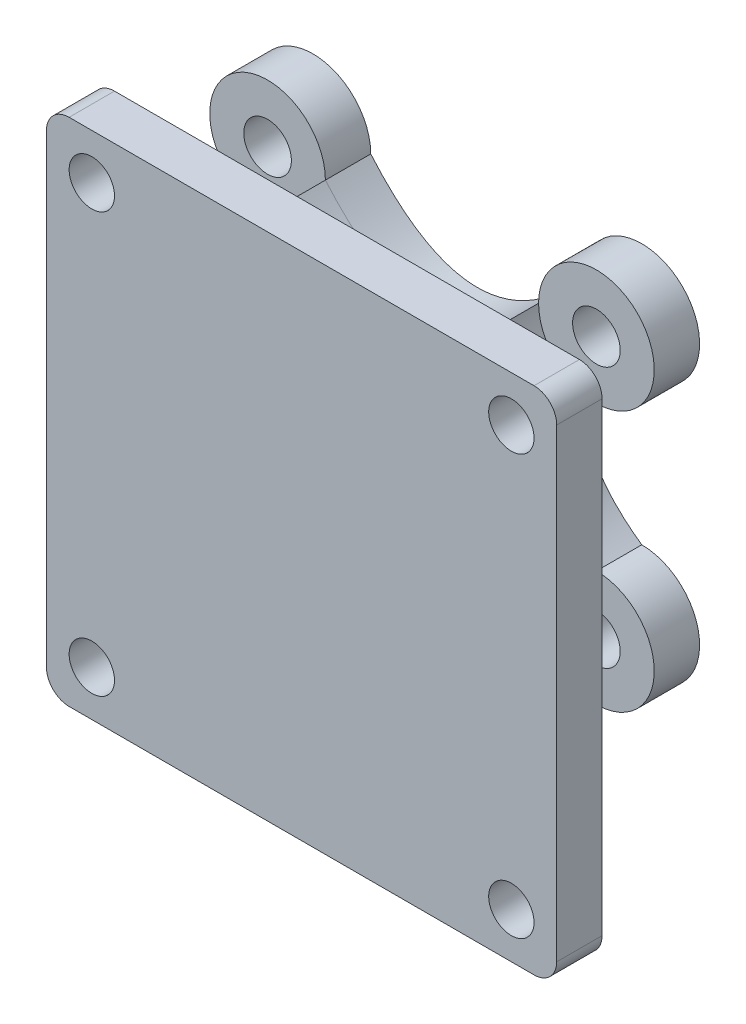
from build123d import *

# Parameters (mm, degrees)
SKETCH_1_R      = 5.1
SKETCH_1_R_2    = 2.1
EXTRUDE_1_DEPTH = 4
EXTRUDE_2_DEPTH = 11.5
SKETCH_3_R      = 2
EXTRUDE_3_DEPTH = 4


with BuildPart() as part:
    # 草圖1 → 填料-伸長1 (new body)
    # profile 1 of 5: a face of its own
    with BuildSketch(Plane.XY):
        with Locations((-14.5, 11.5)):
            Circle(SKETCH_1_R)
        with Locations((-14.5, 11.5)):
            Circle(SKETCH_1_R_2, mode=Mode.SUBTRACT)
    # profile 2 of 5: a face of its own
    with BuildSketch(Plane.XY):
        with BuildLine():
            add(Edge.make_bspline(
                [(-9.4, 11.5), (0, 0.5), (9.4, 11.5)],
                knots=[0, 0, 0, 1, 1, 1], degree=2))
            ThreePointArc((-9.4, 11.5), (-10.893755416, 7.893755416), (-14.5, 6.4))
            add(Edge.make_bspline(
                [(-14.5, 6.4), (-5.5, 0), (-14.5, -6.4)],
                knots=[0, 0, 0, 1, 1, 1], degree=2))
            ThreePointArc((-14.5, -6.4), (-10.893755416, -7.893755416), (-9.4, -11.5))
            add(Edge.make_bspline(
                [(-9.4, -11.5), (0, -0.5), (9.4, -11.5)],
                knots=[0, 0, 0, 1, 1, 1], degree=2))
            ThreePointArc((9.4, -11.5), (10.893755416, -7.893755416), (14.5, -6.4))
            add(Edge.make_bspline(
                [(14.5, 6.4), (5.5, 0), (14.5, -6.4)],
                knots=[0, 0, 0, 1, 1, 1], degree=2))
            ThreePointArc((14.5, 6.4), (10.893755416, 7.893755416), (9.4, 11.5))
        make_face()
    # profile 3 of 5: a face of its own
    with BuildSketch(Plane.XY):
        with Locations((14.5, 11.5)):
            Circle(SKETCH_1_R)
        with Locations((14.5, 11.5)):
            Circle(SKETCH_1_R_2, mode=Mode.SUBTRACT)
    # profile 4 of 5: a face of its own
    with BuildSketch(Plane.XY):
        with Locations((14.5, -11.5)):
            Circle(SKETCH_1_R)
        with Locations((14.5, -11.5)):
            Circle(SKETCH_1_R_2, mode=Mode.SUBTRACT)
    # profile 5 of 5: a face of its own
    with BuildSketch(Plane.XY):
        with Locations((-14.5, -11.5)):
            Circle(SKETCH_1_R)
        with Locations((-14.5, -11.5)):
            Circle(SKETCH_1_R_2, mode=Mode.SUBTRACT)
    extrude(amount=EXTRUDE_1_DEPTH)

    # 草圖2 → 填料-伸長2 (add)
    with BuildSketch(Plane.XY.offset(4)):
        with BuildLine():
            ThreePointArc((-14.5, 6.4), (-10.893755416, 7.893755416), (-9.4, 11.5))
            add(Edge.make_bspline(
                [(9.4, 11.5), (0, 0.5), (-9.4, 11.5)],
                knots=[0, 0, 0, 1, 1, 1], degree=2))
            ThreePointArc((9.4, 11.5), (10.893755425, 7.893755407), (14.500000025, 6.400000018))
            add(Edge.make_bspline(
                [(14.5, -6.4), (5.499999987, 9e-09), (14.500000025, 6.400000018)],
                knots=[0, 0, 0, 1, 1, 1], degree=2))
            ThreePointArc((14.5, -6.4), (10.893755423, -7.893755409), (9.399999984, -11.499999981))
            add(Edge.make_bspline(
                [(-9.4, -11.5), (-8e-09, -0.500000009), (9.399999984, -11.499999981)],
                knots=[0, 0, 0, 1, 1, 1], degree=2))
            ThreePointArc((-9.4, -11.5), (-10.893755425, -7.893755407), (-14.500000025, -6.400000018))
            add(Edge.make_bspline(
                [(-14.5, 6.4), (-5.499999987, -9e-09), (-14.500000025, -6.400000018)],
                knots=[0, 0, 0, 1, 1, 1], degree=2))
        make_face()
    extrude(amount=EXTRUDE_2_DEPTH)

    # 草圖3 → 填料-伸長3 (add)
    with BuildSketch(Plane.XY.offset(15.5)):
        with BuildLine():
            Line((-20.5, 16.5), (20.5, 16.5))
            ThreePointArc((20.5, 16.5), (21.914213562, 15.914213562), (22.5, 14.5))
            Line((22.5, 14.5), (22.5, -26.5))
            ThreePointArc((22.5, -26.5), (21.914213562, -27.914213562), (20.5, -28.5))
            Line((20.5, -28.5), (-20.5, -28.5))
            ThreePointArc((-20.5, -28.5), (-21.914213562, -27.914213562), (-22.5, -26.5))
            Line((-22.5, -26.5), (-22.5, 14.5))
            ThreePointArc((-22.5, 14.5), (-21.914213562, 15.914213562), (-20.5, 16.5))
        make_face()
        with Locations((-18.5, 12.5)):
            Circle(SKETCH_3_R, mode=Mode.SUBTRACT)
        with Locations((-18.5, -24.5)):
            Circle(SKETCH_3_R, mode=Mode.SUBTRACT)
        with Locations((18.5, -24.5)):
            Circle(SKETCH_3_R, mode=Mode.SUBTRACT)
        with Locations((18.5, 12.5)):
            Circle(SKETCH_3_R, mode=Mode.SUBTRACT)
    extrude(amount=-EXTRUDE_3_DEPTH)


solid = part.part
